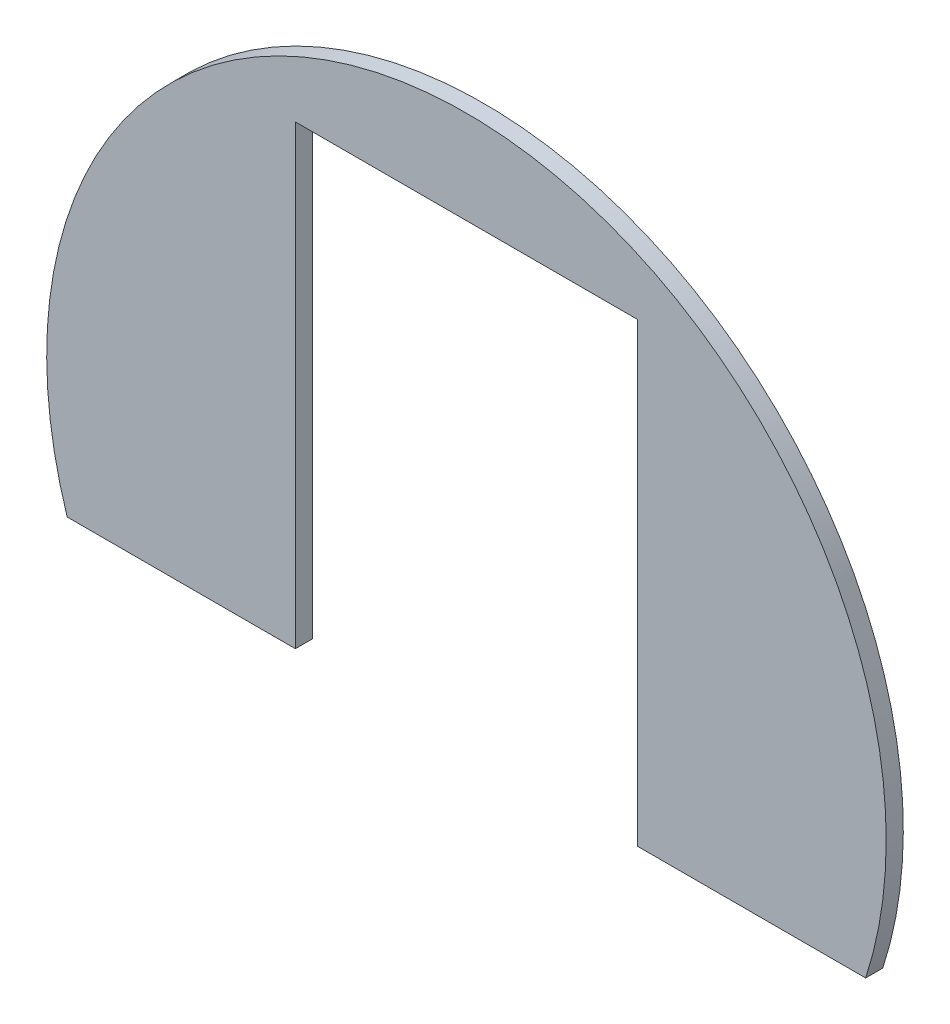
from build123d import *

# Parameters (mm, degrees)
BOSS_EXTRUDE1_DEPTH = 76.2


with BuildPart() as part:
    # Sketch1 → Boss-Extrude1 (new body)
    with BuildSketch(Plane.XY):
        with BuildLine():
            ThreePointArc((1869.44, 0), (1321.893701021, 1321.893701021), (0, 1869.44))
            Line((0, 1869.44), (0, 1454.486438601))
            Line((0, 1454.486438601), (762, 1454.486438601))
            Line((762, 1454.486438601), (762, -577.513561399))
            Line((762, -577.513561399), (1778, -577.513561399))
            ThreePointArc((1778, -577.513561399), (1846.438495266, -292.353889661), (1869.44, 0))
        make_face()
        with BuildLine():
            ThreePointArc((0, 1869.44), (-1512.354598932, 1098.903763161), (-1778, -577.513561399))
            Line((-1778, -577.513561399), (-762, -577.513561399))
            Line((-762, -577.513561399), (-762, 1454.486438601))
            Line((-762, 1454.486438601), (0, 1454.486438601))
            Line((0, 1454.486438601), (0, 1869.44))
        make_face()
    extrude(amount=BOSS_EXTRUDE1_DEPTH)


solid = part.part
